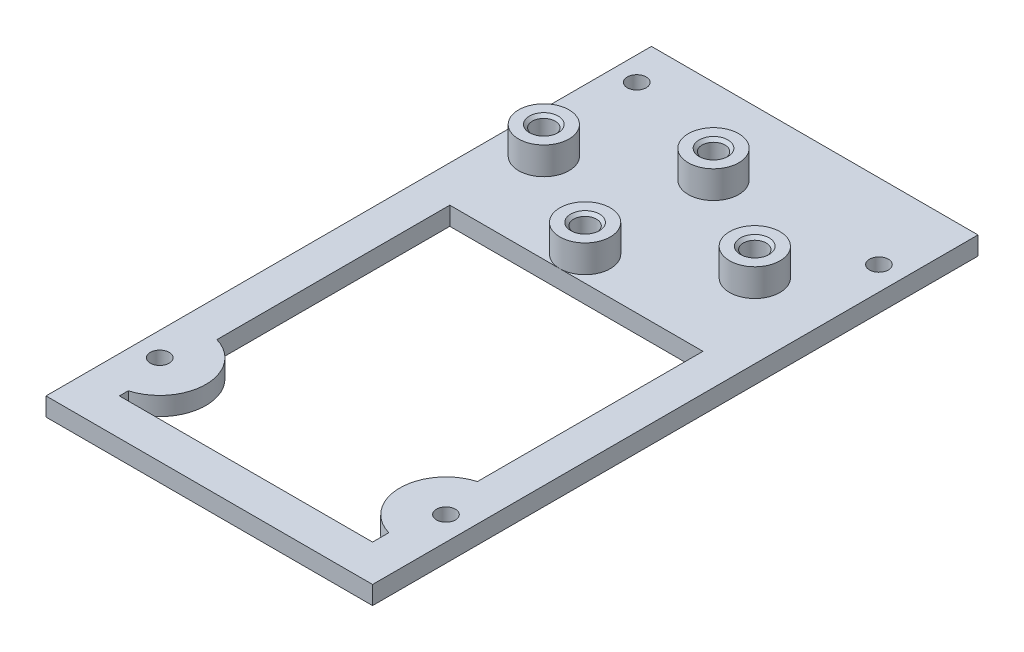
from build123d import *

# Parameters (mm, degrees)
SKETCH1_W                                      = 53.34
SKETCH1_H                                      = 101.6
PCB_PLATE_DEPTH                                = 3.175
F_4_CLEARANCE_HOLE1_D                          = 3.2639
SKETCH5_W                                      = 56.515
SKETCH5_H                                      = 104.775
SKETCH5_W_2                                    = 53.34
SKETCH5_H_2                                    = 101.6
BORDER_MATERIAL_DEPTH                          = 3.175
SKETCH9_R                                      = 4.365625
BOSS_EXTRUDE3_DEPTH                            = 4.7625
CBORE_FOR_4_SOCKET_HEAD_CAP_SCREW3_D           = 3.2639
CBORE_FOR_4_SOCKET_HEAD_CAP_SCREW3_CBORE_D     = 3.96875
CBORE_FOR_4_SOCKET_HEAD_CAP_SCREW3_CBORE_DEPTH = 4.7625
MATERIAL_REDUCTION_CUT_REACH                   = 61.713
CHAMFER2_SIZE                                  = 0.508


with BuildPart() as part:
    # Sketch1 → PCB Plate (new body)
    with BuildSketch(Plane(origin=(0, 0, 0), x_dir=(1, 0, 0), z_dir=(0, 1, 0))):
        Rectangle(SKETCH1_W, SKETCH1_H)
    extrude(amount=PCB_PLATE_DEPTH)

    # #4 Clearance Hole1 (through all)
    with Locations(Plane(origin=(0, 3.175, 0), x_dir=(1, 0, 0), z_dir=(0, 1, 0))):
        with Locations((-24.13, -36.83), (-24.13, 45.72), (24.13, -35.56), (24.13, 39.37)):
            Hole(F_4_CLEARANCE_HOLE1_D / 2)

    # Sketch5 → Border Material (add)
    with BuildSketch(Plane(origin=(0, 0, 0), x_dir=(1, 0, 0), z_dir=(0, 1, 0))):
        Rectangle(SKETCH5_W, SKETCH5_H)
        Rectangle(SKETCH5_W_2, SKETCH5_H_2, mode=Mode.SUBTRACT)
    extrude(amount=BORDER_MATERIAL_DEPTH)

    # Sketch9 → Boss-Extrude3 (add)
    with BuildSketch(Plane(origin=(0, 3.175, 0), x_dir=(1, 0, 0), z_dir=(0, 1, 0))):
        with Locations(Location((-2.8575, 37.7317, 0), (0, 0, 90))):
            Circle(SKETCH9_R)
        with Locations(Location((-21.11375, 26.6192, 0), (0, 0, 90))):
            Circle(SKETCH9_R)
        with Locations(Location((-2.8575, 15.5067, 0), (0, 0, 90))):
            Circle(SKETCH9_R)
        with Locations(Location((15.39875, 26.6192, 0), (0, 0, 90))):
            Circle(SKETCH9_R)
    extrude(amount=BOSS_EXTRUDE3_DEPTH)

    # CBORE for #4 Socket Head Cap Screw3 (through all)
    with Locations(Plane(origin=(0, 7.9375, 0), x_dir=(1, 0, 0), z_dir=(0, 1, 0))):
        with Locations((-2.8575, 37.7317), (-21.11375, 26.6192), (-2.8575, 15.5067), (15.39875, 26.6192)):
            CounterBoreHole(CBORE_FOR_4_SOCKET_HEAD_CAP_SCREW3_D / 2, CBORE_FOR_4_SOCKET_HEAD_CAP_SCREW3_CBORE_D / 2, CBORE_FOR_4_SOCKET_HEAD_CAP_SCREW3_CBORE_DEPTH)

    # Sketch8 → Material Reduction Cut (cut, up to next)
    with BuildSketch(Plane(origin=(0, 3.175, 0), x_dir=(1, 0, 0), z_dir=(0, 1, 0)), mode=Mode.PRIVATE) as material_reduction_cut_sk1:
        with BuildLine():
            Line((-21.9075, 11.141075), (21.9075, 11.141075))
            Line((21.9075, 11.141075), (21.9075, -27.893708879))
            ThreePointArc((21.9075, -27.893708879), (16.14805, -35.56), (21.9075, -43.226291121))
            Line((21.9075, -43.226291121), (21.9075, -46.0375))
            Line((21.9075, -46.0375), (-21.9075, -46.0375))
            Line((-21.9075, -46.0375), (-21.9075, -44.496291121))
            ThreePointArc((-21.9075, -44.496291121), (-16.14805, -36.83), (-21.9075, -29.163708879))
            Line((-21.9075, -29.163708879), (-21.9075, 11.141075))
        make_face()
    material_reduction_cut_tool1 = extrude(material_reduction_cut_sk1.sketch, amount=-MATERIAL_REDUCTION_CUT_REACH, mode=Mode.PRIVATE) & part.part
    add(material_reduction_cut_tool1.solids().sort_by_distance((0, 3.175, 16.421161))[0], mode=Mode.SUBTRACT)

    # Chamfer2
    chamfer2_edges = [part.edges().sort_by_distance(p)[0] for p in [
        (13.414375, 7.9375, -26.6192),
        (-4.841875, 7.9375, -15.5067),
        (-23.098125, 7.9375, -26.6192),
        (-4.841875, 7.9375, -37.7317),
    ]]
    chamfer(chamfer2_edges, length=CHAMFER2_SIZE)


solid = part.part
